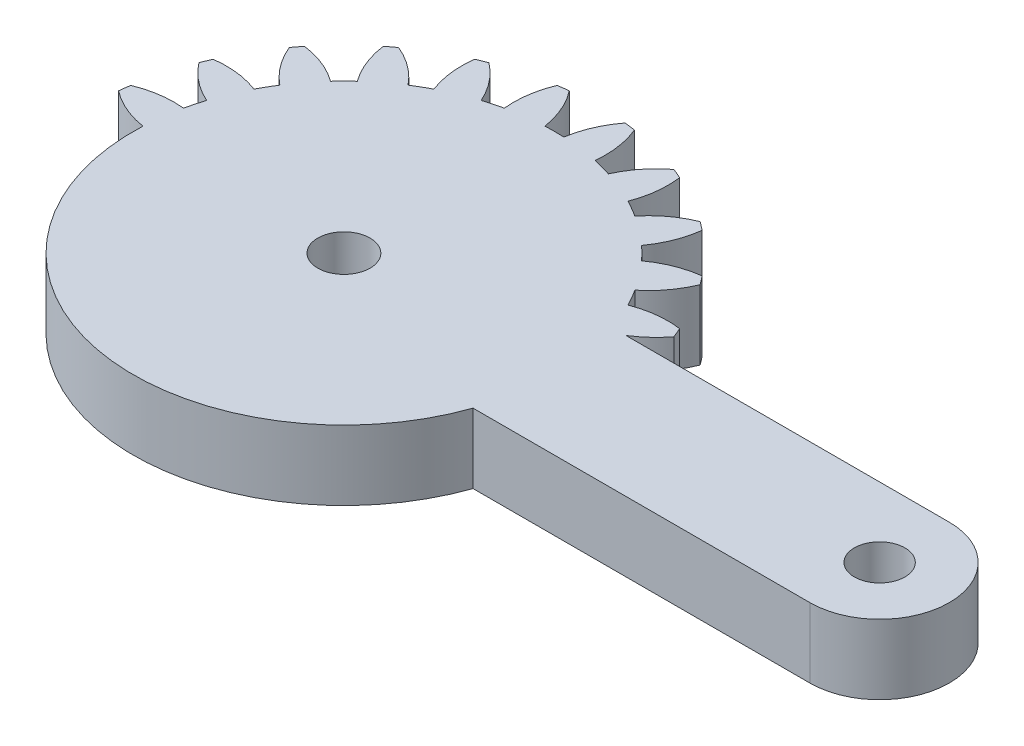
from build123d import *
from build123d.topology import SkipClean

# Parameters (mm, degrees)
SKETCH1_R           = 1.5
SKETCH1_R_2         = 1.45
BOSS_EXTRUDE1_DEPTH = 4
CUT_EXTRUDE1_START  = -10
CUT_EXTRUDE1_DEPTH  = 10


with BuildPart() as part:
    # Sketch1 → Boss-Extrude1 (new body)
    with BuildSketch(Plane(origin=(0, 0, 0), x_dir=(1, 0, 0), z_dir=(0, 1, 0))):
        with BuildLine():
            Line((20.643657446, 4), (2.081641936, 4))
            ThreePointArc((2.081641936, 4), (2.861028333, 4.588201733), (3.521749436, 5.30713988))
            ThreePointArc((3.521749436, 5.30713988), (3.405395609, 5.596745198), (3.282888305, 5.883801663))
            ThreePointArc((3.282888305, 5.883801663), (1.93527598, 5.894040025), (0.627094961, 5.57027124))
            ThreePointArc((0.627094961, 5.57027124), (0.366286148, 6.046375), (0.084372603, 6.510293938))
            ThreePointArc((0.084372603, 6.510293938), (1.018855105, 7.48132754), (1.683794586, 8.65351323))
            ThreePointArc((1.683794586, 8.65351323), (1.496450048, 8.903135899), (1.303821399, 9.148703928))
            ThreePointArc((1.303821399, 9.148703928), (-0.000522033, 8.809805691), (-1.180330337, 8.158486898))
            ThreePointArc((-1.180330337, 8.158486898), (-1.555477026, 8.550865528), (-1.947855656, 8.926012217))
            ThreePointArc((-1.947855656, 8.926012217), (-1.296536862, 10.105820521), (-0.957638625, 11.410163953))
            ThreePointArc((-0.957638625, 11.410163953), (-1.203206655, 11.602792602), (-1.452829324, 11.79013714))
            ThreePointArc((-1.452829324, 11.79013714), (-2.625015014, 11.125197659), (-3.596048616, 10.190715157))
            ThreePointArc((-3.596048616, 10.190715157), (-4.059967554, 10.472628702), (-4.536071314, 10.733437515))
            ThreePointArc((-4.536071314, 10.733437515), (-4.212302529, 12.041618533), (-4.222540891, 13.389230859))
            ThreePointArc((-4.222540891, 13.389230859), (-4.509597355, 13.511738163), (-4.799202674, 13.62809199))
            ThreePointArc((-4.799202674, 13.62809199), (-5.759348103, 12.682425791), (-6.455432668, 11.528463019))
            ThreePointArc((-6.455432668, 11.528463019), (-6.976508546, 11.680699536), (-7.503891752, 11.809396783))
            ThreePointArc((-7.503891752, 11.809396783), (-7.529737283, 13.156800143), (-7.888414517, 14.455843809))
            ThreePointArc((-7.888414517, 14.455843809), (-8.197396993, 14.499881098), (-8.507248835, 14.537314892))
            ThreePointArc((-8.507248835, 14.537314892), (-9.18992168, 13.375367565), (-9.563620196, 12.080565177))
            ThreePointArc((-9.563620196, 12.080565177), (-10.106342554, 12.09275), (-10.649064912, 12.080565177))
            ThreePointArc((-10.649064912, 12.080565177), (-11.022763428, 13.375367565), (-11.705436272, 14.537314892))
            ThreePointArc((-11.705436272, 14.537314892), (-12.015288115, 14.499881098), (-12.324270591, 14.455843809))
            ThreePointArc((-12.324270591, 14.455843809), (-12.682947825, 13.156800143), (-12.708793355, 11.809396783))
            ThreePointArc((-12.708793355, 11.809396783), (-13.236176561, 11.680699536), (-13.757252439, 11.528463019))
            ThreePointArc((-13.757252439, 11.528463019), (-14.453337005, 12.682425791), (-15.413482434, 13.62809199))
            ThreePointArc((-15.413482434, 13.62809199), (-15.703087752, 13.511738163), (-15.990144217, 13.389230859))
            ThreePointArc((-15.990144217, 13.389230859), (-16.000382579, 12.041618533), (-15.676613793, 10.733437515))
            ThreePointArc((-15.676613793, 10.733437515), (-16.152717554, 10.472628702), (-16.616636492, 10.190715157))
            ThreePointArc((-16.616636492, 10.190715157), (-17.587670094, 11.125197659), (-18.759855783, 11.79013714))
            ThreePointArc((-18.759855783, 11.79013714), (-19.009478453, 11.602792602), (-19.255046482, 11.410163953))
            ThreePointArc((-19.255046482, 11.410163953), (-18.916148245, 10.105820521), (-18.264829452, 8.926012217))
            ThreePointArc((-18.264829452, 8.926012217), (-18.657208082, 8.550865528), (-19.032354771, 8.158486898))
            ThreePointArc((-19.032354771, 8.158486898), (-20.212163074, 8.809805691), (-21.516506507, 9.148703928))
            ThreePointArc((-21.516506507, 9.148703928), (-21.709135156, 8.903135899), (-21.896479694, 8.65351323))
            ThreePointArc((-21.896479694, 8.65351323), (-21.231540213, 7.48132754), (-20.297057711, 6.510293938))
            ThreePointArc((-20.297057711, 6.510293938), (-20.578971255, 6.046375), (-20.839780068, 5.57027124))
            ThreePointArc((-20.839780068, 5.57027124), (-22.147961087, 5.894040025), (-23.495573413, 5.883801663))
            ThreePointArc((-23.495573413, 5.883801663), (-23.618080717, 5.596745198), (-23.734434544, 5.30713988))
            ThreePointArc((-23.734434544, 5.30713988), (-22.788768345, 4.346994451), (-21.634805572, 3.650909885))
            ThreePointArc((-21.634805572, 3.650909885), (-21.78704209, 3.129834008), (-21.915739337, 2.602450802))
            ThreePointArc((-21.915739337, 2.602450802), (-23.263142697, 2.576605271), (-24.562186363, 2.217928037))
            ThreePointArc((-24.562186363, 2.217928037), (-24.606223651, 1.908945561), (-24.643657446, 1.599093719))
            ThreePointArc((-24.643657446, 1.599093719), (-23.481710119, 0.916420874), (-22.186907731, 0.542722358))
            ThreePointArc((-22.186907731, 0.542722358), (-22.199092554, 0), (-22.186907731, -0.542722358))
            ThreePointArc((-22.186907731, -0.542722358), (-23.481710119, -0.916420874), (-24.643657446, -1.599093719))
            ThreePointArc((-24.643657446, -1.599093719), (-24.606223651, -1.908945561), (-24.562186363, -2.217928037))
            ThreePointArc((-24.562186363, -2.217928037), (-23.263142697, -2.576605271), (-21.915739337, -2.602450802))
            ThreePointArc((-21.915739337, -2.602450802), (-21.78704209, -3.129834008), (-21.634805572, -3.650909885))
            ThreePointArc((-21.634805572, -3.650909885), (-22.788768345, -4.346994451), (-23.734434544, -5.30713988))
            ThreePointArc((-23.734434544, -5.30713988), (-23.618080717, -5.596745198), (-23.495573413, -5.883801663))
            ThreePointArc((-23.495573413, -5.883801663), (-22.147961087, -5.894040025), (-20.839780068, -5.57027124))
            ThreePointArc((-20.839780068, -5.57027124), (-20.578971255, -6.046375), (-20.297057711, -6.510293938))
            ThreePointArc((-20.297057711, -6.510293938), (-21.231540213, -7.48132754), (-21.896479694, -8.65351323))
            ThreePointArc((-21.896479694, -8.65351323), (-21.709135156, -8.903135899), (-21.516506507, -9.148703928))
            ThreePointArc((-21.516506507, -9.148703928), (-20.212163074, -8.809805691), (-19.032354771, -8.158486898))
            ThreePointArc((-19.032354771, -8.158486898), (-18.657208082, -8.550865528), (-18.264829452, -8.926012217))
            ThreePointArc((-18.264829452, -8.926012217), (-18.916148245, -10.105820521), (-19.255046482, -11.410163953))
            ThreePointArc((-19.255046482, -11.410163953), (-19.009478453, -11.602792602), (-18.759855783, -11.79013714))
            ThreePointArc((-18.759855783, -11.79013714), (-17.587670094, -11.125197659), (-16.616636492, -10.190715157))
            ThreePointArc((-16.616636492, -10.190715157), (-16.152717554, -10.472628702), (-15.676613793, -10.733437515))
            ThreePointArc((-15.676613793, -10.733437515), (-16.000382579, -12.041618533), (-15.990144217, -13.389230859))
            ThreePointArc((-15.990144217, -13.389230859), (-15.703087752, -13.511738163), (-15.413482434, -13.62809199))
            ThreePointArc((-15.413482434, -13.62809199), (-14.453337005, -12.682425791), (-13.757252439, -11.528463019))
            ThreePointArc((-13.757252439, -11.528463019), (-13.236176561, -11.680699536), (-12.708793355, -11.809396783))
            ThreePointArc((-12.708793355, -11.809396783), (-12.682947825, -13.156800143), (-12.324270591, -14.455843809))
            ThreePointArc((-12.324270591, -14.455843809), (-12.015288115, -14.499881098), (-11.705436272, -14.537314892))
            ThreePointArc((-11.705436272, -14.537314892), (-11.022763428, -13.375367565), (-10.649064912, -12.080565177))
            ThreePointArc((-10.649064912, -12.080565177), (-10.106342554, -12.09275), (-9.563620196, -12.080565177))
            ThreePointArc((-9.563620196, -12.080565177), (-9.18992168, -13.375367565), (-8.507248835, -14.537314892))
            ThreePointArc((-8.507248835, -14.537314892), (-8.197396993, -14.499881098), (-7.888414517, -14.455843809))
            ThreePointArc((-7.888414517, -14.455843809), (-7.529737283, -13.156800143), (-7.503891752, -11.809396783))
            ThreePointArc((-7.503891752, -11.809396783), (-6.976508546, -11.680699536), (-6.455432668, -11.528463019))
            ThreePointArc((-6.455432668, -11.528463019), (-5.759348103, -12.682425791), (-4.799202674, -13.62809199))
            ThreePointArc((-4.799202674, -13.62809199), (-4.509597355, -13.511738163), (-4.222540891, -13.389230859))
            ThreePointArc((-4.222540891, -13.389230859), (-4.212302529, -12.041618533), (-4.536071314, -10.733437515))
            ThreePointArc((-4.536071314, -10.733437515), (-4.059967554, -10.472628702), (-3.596048616, -10.190715157))
            ThreePointArc((-3.596048616, -10.190715157), (-2.625015014, -11.125197659), (-1.452829324, -11.79013714))
            ThreePointArc((-1.452829324, -11.79013714), (-1.203206655, -11.602792602), (-0.957638625, -11.410163953))
            ThreePointArc((-0.957638625, -11.410163953), (-1.296536862, -10.105820521), (-1.947855656, -8.926012217))
            ThreePointArc((-1.947855656, -8.926012217), (-1.555477026, -8.550865528), (-1.180330337, -8.158486898))
            ThreePointArc((-1.180330337, -8.158486898), (-0.000522033, -8.809805691), (1.303821399, -9.148703928))
            ThreePointArc((1.303821399, -9.148703928), (1.496450048, -8.903135899), (1.683794586, -8.65351323))
            ThreePointArc((1.683794586, -8.65351323), (1.018855105, -7.48132754), (0.084372603, -6.510293938))
            ThreePointArc((0.084372603, -6.510293938), (0.366286148, -6.046375), (0.627094961, -5.57027124))
            ThreePointArc((0.627094961, -5.57027124), (1.93527598, -5.894040025), (3.282888305, -5.883801663))
            ThreePointArc((3.282888305, -5.883801663), (3.405395609, -5.596745198), (3.521749436, -5.30713988))
            ThreePointArc((3.521749436, -5.30713988), (2.861028333, -4.588201733), (2.081641936, -4))
            Line((2.081641936, -4), (20.643657446, -4))
            ThreePointArc((20.643657446, -4), (24.643657446, 0), (20.643657446, 4))
        make_face()
        with Locations(Location((-10.106342554, 0, 0), (0, 0, 270))):
            Circle(SKETCH1_R, mode=Mode.SUBTRACT)
        with Locations(Location((20.643657446, 0, 0), (0, 0, 270))):
            Circle(SKETCH1_R_2, mode=Mode.SUBTRACT)
    extrude(amount=BOSS_EXTRUDE1_DEPTH)

    # Sketch2 → Cut-Extrude1 (cut)
    with SkipClean():  # the faces are left unmerged after this step: merging them gives an invalid solid
        with BuildSketch(Plane(origin=(0, 4, 0), x_dir=(1, 0, 0), z_dir=(0, 1, 0)).offset(CUT_EXTRUDE1_START)):
            with BuildLine():
                ThreePointArc((-24.562186363, -2.217928037), (-23.263142697, -2.576605271), (-21.915739337, -2.602450802))
                ThreePointArc((-21.915739337, -2.602450802), (-22.095637401, -1.578420611), (-22.186907731, -0.542722358))
                ThreePointArc((-22.186907731, -0.542722358), (-23.481710119, -0.916420874), (-24.643657446, -1.599093719))
                ThreePointArc((-24.643657446, -1.599093719), (-24.606223651, -1.908945561), (-24.562186363, -2.217928037))
            make_face()
            with BuildLine():
                ThreePointArc((-23.495573413, -5.883801663), (-22.147961087, -5.894040025), (-20.839780068, -5.57027124))
                ThreePointArc((-20.839780068, -5.57027124), (-21.278586771, -4.627695077), (-21.634805572, -3.650909885))
                ThreePointArc((-21.634805572, -3.650909885), (-22.788768345, -4.346994451), (-23.734434544, -5.30713988))
                ThreePointArc((-23.734434544, -5.30713988), (-23.618080717, -5.596745198), (-23.495573413, -5.883801663))
            make_face()
            with BuildLine():
                ThreePointArc((-21.516506507, -9.148703928), (-20.212163074, -8.809805691), (-19.032354771, -8.158486898))
                ThreePointArc((-19.032354771, -8.158486898), (-19.70016616, -7.361599771), (-20.297057711, -6.510293938))
                ThreePointArc((-20.297057711, -6.510293938), (-21.231540213, -7.48132754), (-21.896479694, -8.65351323))
                ThreePointArc((-21.896479694, -8.65351323), (-21.709135156, -8.903135899), (-21.516506507, -9.148703928))
            make_face()
            with BuildLine():
                ThreePointArc((-18.759855783, -11.79013714), (-17.587670094, -11.125197659), (-16.616636492, -10.190715157))
                ThreePointArc((-16.616636492, -10.190715157), (-17.467942324, -9.593823606), (-18.264829452, -8.926012217))
                ThreePointArc((-18.264829452, -8.926012217), (-18.916148245, -10.105820521), (-19.255046482, -11.410163953))
                ThreePointArc((-19.255046482, -11.410163953), (-19.009478453, -11.602792602), (-18.759855783, -11.79013714))
            make_face()
            with BuildLine():
                ThreePointArc((-15.413482434, -13.62809199), (-14.453337005, -12.682425791), (-13.757252439, -11.528463019))
                ThreePointArc((-13.757252439, -11.528463019), (-14.734037631, -11.172244217), (-15.676613793, -10.733437515))
                ThreePointArc((-15.676613793, -10.733437515), (-16.000382579, -12.041618533), (-15.990144217, -13.389230859))
                ThreePointArc((-15.990144217, -13.389230859), (-15.703087752, -13.511738163), (-15.413482434, -13.62809199))
            make_face()
            with BuildLine():
                ThreePointArc((-11.705436272, -14.537314892), (-11.022763428, -13.375367565), (-10.649064912, -12.080565177))
                ThreePointArc((-10.649064912, -12.080565177), (-11.684763165, -11.989294847), (-12.708793355, -11.809396783))
                ThreePointArc((-12.708793355, -11.809396783), (-12.682947825, -13.156800143), (-12.324270591, -14.455843809))
                ThreePointArc((-12.324270591, -14.455843809), (-12.015288115, -14.499881098), (-11.705436272, -14.537314892))
            make_face()
            with BuildLine():
                ThreePointArc((-7.888414517, -14.455843809), (-7.529737283, -13.156800143), (-7.503891752, -11.809396783))
                ThreePointArc((-7.503891752, -11.809396783), (-8.527921943, -11.989294847), (-9.563620196, -12.080565177))
                ThreePointArc((-9.563620196, -12.080565177), (-9.18992168, -13.375367565), (-8.507248835, -14.537314892))
                ThreePointArc((-8.507248835, -14.537314892), (-8.197396993, -14.499881098), (-7.888414517, -14.455843809))
            make_face()
            with BuildLine():
                ThreePointArc((-4.222540891, -13.389230859), (-4.212302529, -12.041618533), (-4.536071314, -10.733437515))
                ThreePointArc((-4.536071314, -10.733437515), (-5.478647477, -11.172244217), (-6.455432668, -11.528463019))
                ThreePointArc((-6.455432668, -11.528463019), (-5.759348103, -12.682425791), (-4.799202674, -13.62809199))
                ThreePointArc((-4.799202674, -13.62809199), (-4.509597355, -13.511738163), (-4.222540891, -13.389230859))
            make_face()
            with BuildLine():
                ThreePointArc((-0.957638625, -11.410163953), (-1.296536862, -10.105820521), (-1.947855656, -8.926012217))
                ThreePointArc((-1.947855656, -8.926012217), (-2.744742783, -9.593823606), (-3.596048616, -10.190715157))
                ThreePointArc((-3.596048616, -10.190715157), (-2.625015014, -11.125197659), (-1.452829324, -11.79013714))
                ThreePointArc((-1.452829324, -11.79013714), (-1.203206655, -11.602792602), (-0.957638625, -11.410163953))
            make_face()
            with BuildLine():
                ThreePointArc((1.683794586, -8.65351323), (1.018855105, -7.48132754), (0.084372603, -6.510293938))
                ThreePointArc((0.084372603, -6.510293938), (-0.512518948, -7.361599771), (-1.180330337, -8.158486898))
                ThreePointArc((-1.180330337, -8.158486898), (-0.000522033, -8.809805691), (1.303821399, -9.148703928))
                ThreePointArc((1.303821399, -9.148703928), (1.496450048, -8.903135899), (1.683794586, -8.65351323))
            make_face()
            with BuildLine():
                ThreePointArc((3.521749436, -5.30713988), (2.861028333, -4.588201733), (2.081641936, -4))
                Line((2.081641936, -4), (1.305695063, -4))
                ThreePointArc((1.305695063, -4), (0.994195953, -4.797149927), (0.627094961, -5.57027124))
                ThreePointArc((0.627094961, -5.57027124), (1.93527598, -5.894040025), (3.282888305, -5.883801663))
                ThreePointArc((3.282888305, -5.883801663), (3.405395609, -5.596745198), (3.521749436, -5.30713988))
            make_face()
        extrude(amount=CUT_EXTRUDE1_DEPTH, mode=Mode.SUBTRACT)


solid = part.part
